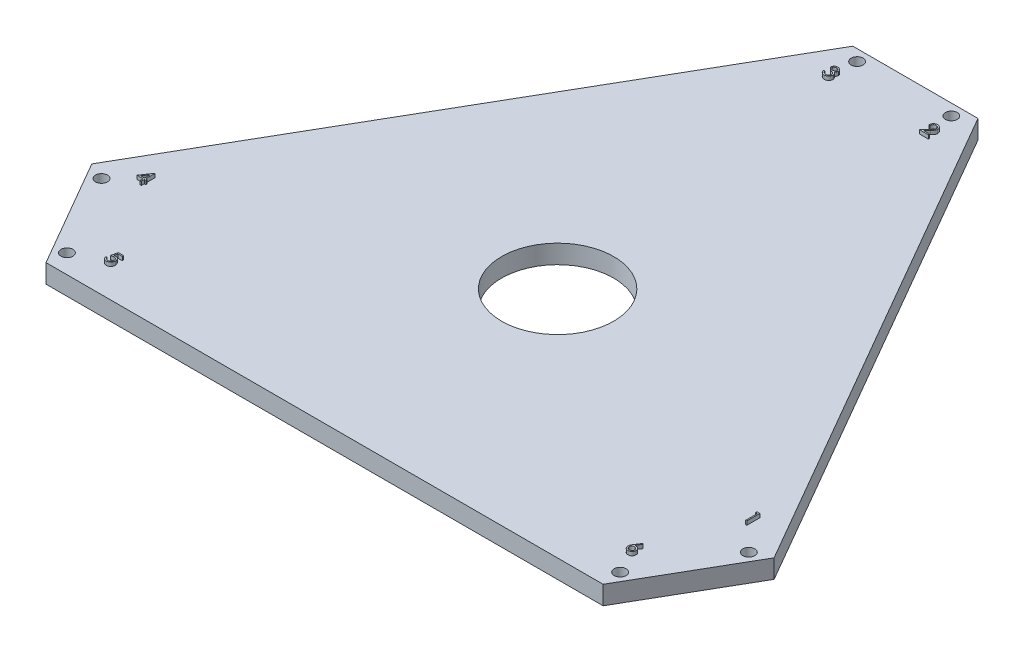
from build123d import *

# Parameters (mm, degrees)
BOSS_EXTRUDE1_DEPTH = 5
BOSS_EXTRUDE2_DEPTH = 1


with BuildPart() as part:
    # Sketch1 → Boss-Extrude1 (new body)
    with BuildSketch(Plane(origin=(0, 0, 0), x_dir=(1, 0, 0), z_dir=(0, 1, 0))):
        Polygon((-74.571158545, -62.397936895), (74.571158545, -62.397936895), (91.323777767, -33.381549243), (16.752619222, 95.779486137), (-16.752619222, 95.779486137), (-91.323777767, -33.381549243), align=None)
        with BuildLine():
            ThreePointArc((0, 15), (-15, 0), (0, -15))
            ThreePointArc((0, -15), (15, 0), (0, 15))
        make_face(mode=Mode.SUBTRACT)
        with BuildLine():
            ThreePointArc((86.654196229, -37.069501717), (88.254196229, -35.469501717), (86.654196229, -33.869501717))
            ThreePointArc((86.654196229, -33.869501717), (85.054196229, -35.469501717), (86.654196229, -37.069501717))
        make_face(mode=Mode.SUBTRACT)
        with BuildLine():
            ThreePointArc((74.044587661, -58.90998442), (75.644587661, -57.30998442), (74.044587661, -55.70998442))
            ThreePointArc((74.044587661, -55.70998442), (72.444587661, -57.30998442), (74.044587661, -58.90998442))
        make_face(mode=Mode.SUBTRACT)
        with BuildLine():
            ThreePointArc((-74.044587661, -58.90998442), (-72.444587661, -57.30998442), (-74.044587661, -55.70998442))
            ThreePointArc((-74.044587661, -55.70998442), (-75.644587661, -57.30998442), (-74.044587661, -58.90998442))
        make_face(mode=Mode.SUBTRACT)
        with BuildLine():
            ThreePointArc((-86.654196229, -37.069501717), (-85.054196229, -35.469501717), (-86.654196229, -33.869501717))
            ThreePointArc((-86.654196229, -33.869501717), (-88.254196229, -35.469501717), (-86.654196229, -37.069501717))
        make_face(mode=Mode.SUBTRACT)
        with BuildLine():
            ThreePointArc((-12.609608568, 94.379486137), (-14.209608568, 92.779486137), (-12.609608568, 91.179486137))
            ThreePointArc((-12.609608568, 91.179486137), (-11.009608568, 92.779486137), (-12.609608568, 94.379486137))
        make_face(mode=Mode.SUBTRACT)
        with BuildLine():
            ThreePointArc((12.609608568, 94.379486137), (11.009608568, 92.779486137), (12.609608568, 91.179486137))
            ThreePointArc((12.609608568, 91.179486137), (14.209608568, 92.779486137), (12.609608568, 94.379486137))
        make_face(mode=Mode.SUBTRACT)
    extrude(amount=BOSS_EXTRUDE1_DEPTH)

    # Sketch2 → Boss-Extrude2 (add)
    # profile 1 of 6: a face of its own
    with BuildSketch(Plane(origin=(0, 5, 0), x_dir=(1, 0, 0), z_dir=(0, 1, 0))):
        Polygon((79.487942702, -25.992269671), (80.135078118, -25.992269671), (80.135078118, -29.492269671), (79.820975554, -29.492269671), (79.820975554, -26.35124403), (79.282514016, -26.35124403), align=None)
    # profile 2 of 6: a face of its own
    with BuildSketch(Plane(origin=(0, 5, 0), x_dir=(1, 0, 0), z_dir=(0, 1, 0))):
        with BuildLine():
            Line((12.979436875, 86.763319042), (12.665334311, 86.763319042))
            add(Edge.make_bspline(
                [(12.665334311, 86.763319042), (12.667381464, 86.80498993), (12.671402018, 86.886830445), (12.690230307, 87.006154351), (12.717171184, 87.12020915), (12.755262638, 87.228079064), (12.802568916, 87.330717871), (12.859298943, 87.427717887), (12.926492794, 87.518709076), (13.002699528, 87.602847919), (13.085468167, 87.68003549), (13.174774107, 87.746690732), (13.268619134, 87.803008404), (13.366718533, 87.850089646), (13.470179096, 87.885429492), (13.578061954, 87.911651131), (13.690841091, 87.927427477), (13.767681113, 87.929123262), (13.806760593, 87.929985709)],
                knots=[0, 0, 0, 0, 1.10065271, 2.161652631, 3.183658789, 4.190468796, 5.17591951, 6.163126047, 7.15150782, 8.156236427, 9.156009102, 10.134482811, 11.092018607, 12.041330605, 13.001268258, 13.972401359, 14.968799086, 16, 16, 16, 16], degree=3))
            add(Edge.make_bspline(
                [(13.806760593, 87.929985709), (13.845138667, 87.929087253), (13.920550212, 87.927321818), (14.030612226, 87.912160789), (14.13538952, 87.888415197), (14.234677287, 87.855099781), (14.327683352, 87.810315353), (14.415106396, 87.756517815), (14.497987207, 87.694297983), (14.572593991, 87.62104417), (14.64110207, 87.542841785), (14.700204325, 87.459353882), (14.750817488, 87.373124596), (14.793005168, 87.283496394), (14.824061307, 87.189625366), (14.847639515, 87.092878163), (14.860966929, 86.992253352), (14.863012352, 86.924146797), (14.86405226, 86.889520966)],
                knots=[0, 0, 0, 0, 1.111607364, 2.184268762, 3.212621178, 4.221274766, 5.211760367, 6.196651075, 7.1921475, 8.207485113, 9.220403448, 10.201281604, 11.166441695, 12.114753415, 13.065576456, 14.026450734, 14.996634279, 16, 16, 16, 16], degree=3))
            add(Edge.make_bspline(
                [(14.86405226, 86.889520966), (14.862358997, 86.840773131), (14.859002185, 86.744132917), (14.830287809, 86.602118055), (14.785441298, 86.464524635), (14.731443941, 86.353787333), (14.676971497, 86.26455384), (14.627883989, 86.191085135), (14.570419178, 86.111979666), (14.50374068, 86.027502329), (14.429227808, 85.936991424), (14.346205645, 85.840501628), (14.254082163, 85.739029859), (14.189423662, 85.669724257), (14.155919247, 85.633811831)],
                knots=[0, 0, 0, 0, 1.184426356, 2.348067706, 3.509069118, 4.696110526, 5.333549288, 6.050745305, 6.844228056, 7.710549037, 8.667450064, 9.695053472, 10.805634456, 12, 12, 12, 12], degree=3))
            Line((14.155919247, 85.633811831), (13.280218125, 84.699216478))
            Line((13.280218125, 84.699216478), (14.908924054, 84.699216478))
            Line((14.908924054, 84.699216478), (14.908924054, 84.340242119))
            Line((14.908924054, 84.340242119), (12.530718926, 84.340242119))
            Line((12.530718926, 84.340242119), (13.888090721, 85.788759748))
            add(Edge.make_bspline(
                [(13.888090721, 85.788759748), (13.921138608, 85.823258054), (13.984616835, 85.889522241), (14.074399412, 85.986265201), (14.1550384, 86.076014742), (14.227055793, 86.15860129), (14.288889298, 86.235232858), (14.34376153, 86.303427561), (14.387727121, 86.366182012), (14.435442517, 86.438922626), (14.481656498, 86.527734943), (14.521368854, 86.636268632), (14.545583703, 86.747995885), (14.548488538, 86.823497922), (14.549949695, 86.861476094)],
                knots=[0, 0, 0, 0, 1.329631726, 2.553950428, 3.673215718, 4.687767853, 5.603093632, 6.413772471, 7.123043292, 7.734684054, 8.834405432, 9.900288307, 10.943827018, 12, 12, 12, 12], degree=3))
            add(Edge.make_bspline(
                [(14.549949695, 86.861476094), (14.549313953, 86.885357492), (14.548061027, 86.932423143), (14.53700333, 87.001428902), (14.520292824, 87.067993715), (14.496347565, 87.132322334), (14.464740825, 87.193767987), (14.426267445, 87.252405467), (14.381877382, 87.309094432), (14.330526113, 87.36224773), (14.274114593, 87.410928935), (14.214520343, 87.454053021), (14.151470239, 87.490092132), (14.085230117, 87.519635629), (14.015984647, 87.54281101), (13.943599902, 87.558869589), (13.868275886, 87.568952073), (13.81684239, 87.570316245), (13.790634792, 87.57101135)],
                knots=[0, 0, 0, 0, 0.991446411, 1.95395049, 2.89581595, 3.838931463, 4.798493298, 5.75982156, 6.748411868, 7.785213223, 8.824556874, 9.840280684, 10.836137867, 11.835679398, 12.848801643, 13.863922112, 14.911575587, 16, 16, 16, 16], degree=3))
            add(Edge.make_bspline(
                [(13.790634792, 87.57101135), (13.763263959, 87.570296318), (13.709512163, 87.568892113), (13.63059313, 87.559069449), (13.555307352, 87.542123608), (13.483465449, 87.518946934), (13.414945863, 87.489488385), (13.350081819, 87.45279664), (13.28901893, 87.409013147), (13.231642407, 87.359372591), (13.178778428, 87.30410499), (13.132331552, 87.242495027), (13.091747538, 87.175667611), (13.056338304, 87.103803061), (13.027582614, 87.026249281), (13.005609464, 86.943281576), (12.988222617, 86.855260194), (12.982414096, 86.794475109), (12.979436875, 86.763319042)],
                knots=[0, 0, 0, 0, 1.031018746, 2.02475058, 2.990194455, 3.934040569, 4.864654155, 5.795059489, 6.735614925, 7.690564532, 8.649604399, 9.611025574, 10.590972636, 11.591080095, 12.624614302, 13.701020113, 14.821632451, 16, 16, 16, 16], degree=3))
        make_face()
    # profile 3 of 6: a face of its own
    with BuildSketch(Plane(origin=(0, 5, 0), x_dir=(1, 0, 0), z_dir=(0, 1, 0))):
        with BuildLine():
            Line((-13.626834141, 87.032549812), (-13.940936705, 87.032549812))
            add(Edge.make_bspline(
                [(-13.940936705, 87.032549812), (-13.932427155, 87.067782296), (-13.915791679, 87.13665892), (-13.881094106, 87.235066181), (-13.84329485, 87.328189702), (-13.797905746, 87.414285776), (-13.748396992, 87.495084679), (-13.69167427, 87.568753803), (-13.630354547, 87.637166769), (-13.562529598, 87.697880006), (-13.491400936, 87.752857735), (-13.415966317, 87.799732793), (-13.337743423, 87.840056946), (-13.25619029, 87.873277178), (-13.171064118, 87.898302701), (-13.083134495, 87.916459507), (-12.992170995, 87.928250621), (-12.930423404, 87.929401384), (-12.899069718, 87.929985709)],
                knots=[0, 0, 0, 0, 1.162005537, 2.271625781, 3.343758855, 4.383309926, 5.390229558, 6.379919256, 7.361854164, 8.333198761, 9.295911338, 10.242430842, 11.177959212, 12.116337295, 13.062827104, 14.020064771, 14.994644689, 16, 16, 16, 16], degree=3))
            add(Edge.make_bspline(
                [(-12.899069718, 87.929985709), (-12.853386976, 87.928606479), (-12.763017965, 87.925878103), (-12.630254918, 87.900963667), (-12.502228099, 87.861538535), (-12.380338851, 87.807064807), (-12.267120419, 87.739877494), (-12.166384232, 87.659912757), (-12.079495721, 87.568713456), (-12.006601343, 87.467980892), (-11.949526344, 87.360325382), (-11.907439971, 87.249525225), (-11.88181829, 87.135843254), (-11.878497733, 87.059085974), (-11.876834141, 87.020630741)],
                knots=[0, 0, 0, 0, 1.083050992, 2.142477498, 3.193116406, 4.255571735, 5.30263384, 6.308962982, 7.297363603, 8.282367274, 9.249857812, 10.179914175, 11.08814088, 12, 12, 12, 12], degree=3))
            add(Edge.make_bspline(
                [(-11.876834141, 87.020630741), (-11.877997732, 86.983623946), (-11.880274699, 86.911207392), (-11.899608405, 86.805485895), (-11.932144668, 86.705844295), (-11.97721443, 86.611863132), (-12.035555981, 86.524138293), (-12.106228677, 86.442472402), (-12.189731339, 86.366503244), (-12.253010277, 86.322983771), (-12.285588148, 86.300578658)],
                knots=[0, 0, 0, 0, 1.024540389, 2.004866551, 2.965041327, 3.920577974, 4.882998113, 5.874504559, 6.905732034, 8, 8, 8, 8], degree=3))
            add(Edge.make_bspline(
                [(-12.285588148, 86.300578658), (-12.248356393, 86.282600486), (-12.174589519, 86.246980529), (-12.074038989, 86.177124771), (-11.982761114, 86.096468424), (-11.931857395, 86.033525771), (-11.906281257, 86.001900773)],
                knots=[0, 0, 0, 0, 1.015518401, 2.012035669, 3.001164323, 4, 4, 4, 4], degree=3))
            add(Edge.make_bspline(
                [(-11.906281257, 86.001900773), (-11.889439914, 85.978843022), (-11.856033018, 85.933105105), (-11.814797484, 85.859568679), (-11.77738837, 85.78521719), (-11.748238151, 85.708057784), (-11.725664284, 85.62898477), (-11.709528252, 85.547862374), (-11.699504111, 85.464624352), (-11.698068559, 85.408311871), (-11.697346962, 85.380005741)],
                knots=[0, 0, 0, 0, 1.025084078, 2.033381695, 3.024893161, 4.013698104, 4.991890475, 5.976764909, 6.982997093, 8, 8, 8, 8], degree=3))
            add(Edge.make_bspline(
                [(-11.697346962, 85.380005741), (-11.699141475, 85.33099602), (-11.702722057, 85.233207218), (-11.734726131, 85.088732497), (-11.784339372, 84.947506994), (-11.854796308, 84.812432155), (-11.940663817, 84.686051774), (-12.042821141, 84.572975465), (-12.16010755, 84.475776861), (-12.290913198, 84.394566633), (-12.432630327, 84.32964871), (-12.584205919, 84.284591268), (-12.743455973, 84.255245268), (-12.85266327, 84.252098399), (-12.908184301, 84.25049853)],
                knots=[0, 0, 0, 0, 0.955779014, 1.907060117, 2.875433937, 3.871313158, 4.872415639, 5.851225146, 6.836215519, 7.83643374, 8.849228613, 9.86973379, 10.916971861, 12, 12, 12, 12], degree=3))
            add(Edge.make_bspline(
                [(-12.908184301, 84.25049853), (-12.945603602, 84.251366743), (-13.019232307, 84.253075097), (-13.127475805, 84.264753698), (-13.230797504, 84.286083704), (-13.329337102, 84.314787009), (-13.423182139, 84.351178751), (-13.512046244, 84.396497449), (-13.596476137, 84.449808951), (-13.675675089, 84.511742539), (-13.749633656, 84.581023879), (-13.816386381, 84.658882889), (-13.877046173, 84.743880292), (-13.929988812, 84.837003349), (-13.977625765, 84.937048606), (-14.016806721, 85.045297104), (-14.05129229, 85.160781126), (-14.067325754, 85.241258867), (-14.07555209, 85.282549812)],
                knots=[0, 0, 0, 0, 1.048658725, 2.063410685, 3.046034179, 4.001477787, 4.936774919, 5.862367409, 6.792675028, 7.730719943, 8.675894397, 9.627829632, 10.600096036, 11.597688215, 12.626045268, 13.701542398, 14.82072376, 16, 16, 16, 16], degree=3))
            Line((-14.07555209, 85.282549812), (-13.761449526, 85.282549812))
            add(Edge.make_bspline(
                [(-13.761449526, 85.282549812), (-13.753266234, 85.255600798), (-13.737349022, 85.203182627), (-13.710254724, 85.127742321), (-13.679386452, 85.058584268), (-13.646271893, 84.995201146), (-13.611493447, 84.936968743), (-13.572578522, 84.885426874), (-13.532409377, 84.838311672), (-13.502130023, 84.81176706), (-13.487310904, 84.798775773)],
                knots=[0, 0, 0, 0, 1.198163088, 2.33053128, 3.407730985, 4.417276592, 5.372219308, 6.28897303, 7.162600585, 8, 8, 8, 8], degree=3))
            add(Edge.make_bspline(
                [(-13.487310904, 84.798775773), (-13.467714327, 84.783667439), (-13.428581665, 84.753497408), (-13.364813433, 84.714995779), (-13.297748547, 84.681634754), (-13.225933873, 84.656151058), (-13.150919103, 84.634573397), (-13.071491737, 84.620452878), (-12.98835252, 84.610764707), (-12.931584757, 84.609909775), (-12.902575327, 84.609472889)],
                knots=[0, 0, 0, 0, 0.946170439, 1.889420265, 2.845303464, 3.807233317, 4.801018734, 5.828864929, 6.890507805, 8, 8, 8, 8], degree=3))
            add(Edge.make_bspline(
                [(-12.902575327, 84.609472889), (-12.869821824, 84.610088794), (-12.805775177, 84.611293143), (-12.712320318, 84.62236885), (-12.623412871, 84.638499264), (-12.540039945, 84.663412247), (-12.461109437, 84.694193098), (-12.387727788, 84.732841503), (-12.318931682, 84.778186225), (-12.255602276, 84.829725384), (-12.198656769, 84.886146879), (-12.148517255, 84.94515995), (-12.105892594, 85.006515779), (-12.071509016, 85.0705539), (-12.044358465, 85.137009129), (-12.025875265, 85.206067959), (-12.01302375, 85.277165225), (-12.011977138, 85.325494194), (-12.011449526, 85.349857504)],
                knots=[0, 0, 0, 0, 1.217147791, 2.380027433, 3.494444702, 4.572153297, 5.609568379, 6.639424714, 7.649109417, 8.668170816, 9.669597737, 10.625200337, 11.543417969, 12.441394052, 13.322311151, 14.205496177, 15.095365482, 16, 16, 16, 16], degree=3))
            add(Edge.make_bspline(
                [(-12.011449526, 85.349857504), (-12.012979827, 85.382468843), (-12.016032816, 85.447529251), (-12.039341395, 85.543246825), (-12.077680259, 85.635470238), (-12.131352771, 85.722626028), (-12.196688499, 85.803401929), (-12.273053406, 85.875473412), (-12.361081635, 85.934943503), (-12.442101504, 85.976032159), (-12.51386666, 86.004069235), (-12.575282045, 86.022744199), (-12.644038648, 86.038557855), (-12.719304997, 86.053270126), (-12.801648213, 86.065791474), (-12.890978651, 86.07623329), (-12.987314413, 86.084588331), (-13.054005579, 86.088319426), (-13.088372603, 86.090242119)],
                knots=[0, 0, 0, 0, 1.07054697, 2.135767047, 3.216561865, 4.33974944, 5.486079747, 6.621378074, 7.775625952, 8.963672916, 9.598146892, 10.304877434, 11.070270905, 11.915000392, 12.823868403, 13.805723172, 14.86925407, 16, 16, 16, 16], degree=3))
            Line((-13.088372603, 86.090242119), (-13.088372603, 86.449216478))
            add(Edge.make_bspline(
                [(-13.088372603, 86.449216478), (-13.045071437, 86.449951282), (-12.96025509, 86.451390582), (-12.836360786, 86.468798592), (-12.717887473, 86.492879221), (-12.607460731, 86.529764413), (-12.506812018, 86.57260471), (-12.419492416, 86.622456919), (-12.346725269, 86.677871668), (-12.288864197, 86.739704278), (-12.245334969, 86.806019325), (-12.213508171, 86.875135983), (-12.194707845, 86.947660044), (-12.192198178, 86.997154712), (-12.190936705, 87.022032985)],
                knots=[0, 0, 0, 0, 1.321986639, 2.589447074, 3.816329219, 5.01088745, 6.139805852, 7.153945165, 8.075214402, 8.924034688, 9.728124013, 10.488707548, 11.240355623, 12, 12, 12, 12], degree=3))
            add(Edge.make_bspline(
                [(-12.190936705, 87.022032985), (-12.191351116, 87.04031073), (-12.192175567, 87.076673437), (-12.202572845, 87.129798506), (-12.218196886, 87.181299452), (-12.239676615, 87.230957262), (-12.268426814, 87.278427536), (-12.3028328, 87.324114985), (-12.343800901, 87.367758764), (-12.390746348, 87.408439083), (-12.441158153, 87.44720832), (-12.496407928, 87.480121957), (-12.554829802, 87.508267019), (-12.616488457, 87.531476522), (-12.681583988, 87.54893581), (-12.749810545, 87.561471651), (-12.821298229, 87.569309306), (-12.870069961, 87.570437722), (-12.894862987, 87.57101135)],
                knots=[0, 0, 0, 0, 0.884392785, 1.759457502, 2.611959086, 3.489218968, 4.37281399, 5.2945488, 6.255912374, 7.266815255, 8.301784654, 9.332968512, 10.37626691, 11.440494194, 12.520033166, 13.637162961, 14.798855837, 16, 16, 16, 16], degree=3))
            add(Edge.make_bspline(
                [(-12.894862987, 87.57101135), (-12.934714655, 87.569619988), (-13.012554232, 87.566902335), (-13.124769149, 87.543099321), (-13.229088483, 87.505121238), (-13.308827149, 87.459788218), (-13.367709723, 87.415037784), (-13.409786662, 87.375955398), (-13.451107172, 87.332522574), (-13.488952849, 87.282064199), (-13.527226825, 87.227997409), (-13.562071387, 87.167573727), (-13.595931079, 87.102369333), (-13.616333629, 87.056273698), (-13.626834141, 87.032549812)],
                knots=[0, 0, 0, 0, 1.472543308, 2.876219568, 4.221790263, 5.565193594, 6.249813518, 6.953379497, 7.687249741, 8.463570142, 9.283606569, 10.136032583, 11.040678096, 12, 12, 12, 12], degree=3))
        make_face()
    # profile 4 of 6: a face of its own
    with BuildSketch(Plane(origin=(0, 5, 0), x_dir=(1, 0, 0), z_dir=(0, 1, 0))):
        Polygon((-79.7388767, -28.170105997), (-79.675074616, -28.170105997), (-79.675074616, -30.59318292), (-79.271228463, -30.59318292), (-79.271228463, -30.952157279), (-79.675074616, -30.952157279), (-79.675074616, -31.759849587), (-79.989177181, -31.759849587), (-79.989177181, -30.952157279), (-81.649433591, -30.952157279), align=None)
        Polygon((-79.989177181, -30.59318292), (-79.989177181, -29.073150869), (-81.032446411, -30.59318292), align=None, mode=Mode.SUBTRACT)
    # profile 5 of 6: a face of its own
    with BuildSketch(Plane(origin=(0, 5, 0), x_dir=(1, 0, 0), z_dir=(0, 1, 0))):
        with BuildLine():
            Line((-64.787032184, -51.389164732), (-64.787032184, -51.74813909))
            Line((-64.787032184, -51.74813909), (-65.977536992, -51.74813909))
            Line((-65.977536992, -51.74813909), (-66.166138755, -52.668712007))
            add(Edge.make_bspline(
                [(-66.166138755, -52.668712007), (-66.12908288, -52.658481735), (-66.057292985, -52.638662202), (-65.951333124, -52.616656431), (-65.85074092, -52.603390987), (-65.78546555, -52.601579677), (-65.753879139, -52.600703193)],
                knots=[0, 0, 0, 0, 1.100273476, 2.13160584, 3.095893838, 4, 4, 4, 4], degree=3))
            add(Edge.make_bspline(
                [(-65.753879139, -52.600703193), (-65.7147954, -52.601549129), (-65.637947002, -52.60321245), (-65.525508055, -52.619184299), (-65.418175162, -52.644324214), (-65.316172792, -52.679444735), (-65.219312241, -52.724354469), (-65.12848468, -52.780454409), (-65.042326767, -52.84598774), (-64.962384173, -52.921332752), (-64.889859865, -53.004254369), (-64.826093875, -53.09341224), (-64.771931285, -53.187939902), (-64.72837053, -53.288740511), (-64.693586196, -53.394699664), (-64.670434201, -53.506932247), (-64.655017492, -53.624380367), (-64.653295106, -53.704684937), (-64.6524168, -53.745635084)],
                knots=[0, 0, 0, 0, 1.052922333, 2.070308379, 3.05430497, 4.020497103, 4.973039431, 5.925935799, 6.892292201, 7.88610001, 8.88166317, 9.857072816, 10.836096531, 11.812156883, 12.81219415, 13.836441305, 14.89672472, 16, 16, 16, 16], degree=3))
            add(Edge.make_bspline(
                [(-64.6524168, -53.745635084), (-64.653081875, -53.774157304), (-64.654403038, -53.830816292), (-64.661121625, -53.914960493), (-64.674057341, -53.997323326), (-64.691425065, -54.077915718), (-64.713967483, -54.15658509), (-64.741256537, -54.233556618), (-64.774652565, -54.308351224), (-64.81128394, -54.381676619), (-64.852530418, -54.451875127), (-64.898308925, -54.517524113), (-64.946674417, -54.579608395), (-64.998715802, -54.637462128), (-65.054916797, -54.690705146), (-65.114596764, -54.739653427), (-65.177279483, -54.785134757), (-65.243934725, -54.825302953), (-65.313077208, -54.862265909), (-65.385705426, -54.892589446), (-65.460166126, -54.919699974), (-65.537531002, -54.941309502), (-65.617624814, -54.958242056), (-65.70057959, -54.969742657), (-65.78596026, -54.978119094), (-65.843835272, -54.978643451), (-65.873069845, -54.978908321)],
                knots=[0, 0, 0, 0, 1.056347294, 2.098418968, 3.122841568, 4.141288669, 5.149314143, 6.15115421, 7.162517403, 8.180376062, 9.185164535, 10.17417709, 11.141909838, 12.097768115, 13.052685741, 14.0056014, 14.954263652, 15.917497458, 16.885230207, 17.854509472, 18.828990115, 19.81800267, 20.826176721, 21.857883937, 22.917946725, 24, 24, 24, 24], degree=3))
            add(Edge.make_bspline(
                [(-65.873069845, -54.978908321), (-65.907944025, -54.978217483), (-65.976554856, -54.976858341), (-66.077075423, -54.962639856), (-66.173790029, -54.94227594), (-66.26592013, -54.91163967), (-66.354291394, -54.873252375), (-66.437714111, -54.824736203), (-66.518319887, -54.7697571), (-66.592831924, -54.704876747), (-66.661988038, -54.633961065), (-66.723894547, -54.557003424), (-66.779028123, -54.475273981), (-66.82650587, -54.388375827), (-66.867003892, -54.296537296), (-66.89881888, -54.199414296), (-66.924497235, -54.097514292), (-66.935360655, -54.027360781), (-66.940878338, -53.991728834)],
                knots=[0, 0, 0, 0, 1.0467383, 2.05933395, 3.04377827, 4.011590433, 4.970194871, 5.932262533, 6.905835911, 7.896367577, 8.894135286, 9.877477877, 10.858688626, 11.851381753, 12.8477658, 13.868841284, 14.917554742, 16, 16, 16, 16], degree=3))
            Line((-66.940878338, -53.991728834), (-66.626775774, -53.991728834))
            add(Edge.make_bspline(
                [(-66.626775774, -53.991728834), (-66.619047217, -54.025105287), (-66.6041925, -54.089256681), (-66.571586752, -54.179388023), (-66.531720876, -54.259707246), (-66.484316528, -54.33127683), (-66.427766497, -54.393685827), (-66.363237068, -54.449302889), (-66.290889345, -54.499478018), (-66.210496115, -54.541300785), (-66.125683036, -54.576969539), (-66.036915826, -54.600721234), (-65.94661148, -54.617422127), (-65.885533109, -54.619093887), (-65.854840678, -54.619933962)],
                knots=[0, 0, 0, 0, 1.136247022, 2.183929868, 3.172523383, 4.106158343, 5.02341133, 5.958108904, 6.928429099, 7.938127109, 8.96079061, 9.975095812, 10.982467395, 12, 12, 12, 12], degree=3))
            add(Edge.make_bspline(
                [(-65.854840678, -54.619933962), (-65.824882234, -54.619113184), (-65.765893811, -54.617497066), (-65.679082425, -54.605058054), (-65.59526955, -54.585900483), (-65.515282194, -54.557230628), (-65.437720654, -54.522385909), (-65.364546884, -54.477670833), (-65.293644007, -54.426210815), (-65.227215873, -54.367254185), (-65.166376424, -54.30228449), (-65.112620303, -54.232807097), (-65.067843389, -54.15869025), (-65.03010928, -54.081217097), (-65.001455982, -53.99953854), (-64.981015, -53.914037365), (-64.969011941, -53.824502385), (-64.967360761, -53.763433075), (-64.966519364, -53.73231377)],
                knots=[0, 0, 0, 0, 1.027316725, 2.022795036, 3.002884548, 3.971462791, 4.93288096, 5.914575861, 6.907176829, 7.935150275, 8.956128384, 9.956726525, 10.942570165, 11.921478529, 12.907843606, 13.90538589, 14.932640048, 16, 16, 16, 16], degree=3))
            add(Edge.make_bspline(
                [(-64.966519364, -53.73231377), (-64.967177843, -53.704238018), (-64.968466723, -53.649283729), (-64.978997293, -53.568884523), (-64.997314266, -53.492811481), (-65.022738146, -53.420697247), (-65.055017653, -53.352473804), (-65.094463966, -53.288070744), (-65.141817364, -53.228336911), (-65.195909252, -53.173244357), (-65.255167293, -53.122399482), (-65.320611036, -53.079055396), (-65.390870963, -53.042591478), (-65.465100562, -53.01112348), (-65.545065461, -52.988522734), (-65.629182093, -52.971554849), (-65.718358801, -52.961739486), (-65.779329489, -52.960377598), (-65.810670005, -52.959677552)],
                knots=[0, 0, 0, 0, 1.045622112, 2.046656509, 3.013763289, 3.955457236, 4.890082067, 5.820317437, 6.762574623, 7.722996705, 8.69280354, 9.665887285, 10.63943826, 11.638615906, 12.663482002, 13.728887084, 14.832589034, 16, 16, 16, 16], degree=3))
            add(Edge.make_bspline(
                [(-65.810670005, -52.959677552), (-65.837798934, -52.960258143), (-65.893813289, -52.961456917), (-65.979736116, -52.970283413), (-66.070027839, -52.984522708), (-66.164342334, -53.004108955), (-66.262962842, -53.029740032), (-66.365681243, -53.060454533), (-66.47271351, -53.097176531), (-66.544831234, -53.124908745), (-66.581903979, -53.139164732)],
                knots=[0, 0, 0, 0, 0.817624296, 1.688186739, 2.600797293, 3.572016777, 4.590301741, 5.671205678, 6.80286297, 8, 8, 8, 8], degree=3))
            Line((-66.581903979, -53.139164732), (-66.22292962, -51.389164732))
            Line((-66.22292962, -51.389164732), (-64.787032184, -51.389164732))
        make_face()
    # profile 6 of 6: a face of its own
    with BuildSketch(Plane(origin=(0, 5, 0), x_dir=(1, 0, 0), z_dir=(0, 1, 0))):
        with BuildLine():
            Line((71.440289423, -48.578325242), (71.682176442, -48.768329249))
            Line((71.682176442, -48.768329249), (70.757396794, -50.182491909))
            add(Edge.make_bspline(
                [(70.757396794, -50.182491909), (70.818967071, -50.172678048), (70.939066858, -50.153535004), (71.060632757, -50.150377058), (71.119876762, -50.148838063)],
                knots=[0, 0, 0, 0, 1.025318673, 2, 2, 2, 2], degree=3))
            add(Edge.make_bspline(
                [(71.119876762, -50.148838063), (71.155449259, -50.149794175), (71.225472659, -50.151676252), (71.328279461, -50.166160103), (71.427068397, -50.188985215), (71.52143001, -50.222257471), (71.611702991, -50.264759825), (71.698405388, -50.315698695), (71.779907398, -50.377704376), (71.857258577, -50.446969331), (71.927485674, -50.523686316), (71.98966173, -50.605087653), (72.041888522, -50.691088534), (72.084262443, -50.7816454), (72.117167322, -50.876618659), (72.141154967, -50.975886799), (72.15533456, -51.07951827), (72.15726005, -51.149996445), (72.158238141, -51.185797198)],
                knots=[0, 0, 0, 0, 1.04369286, 2.054478336, 3.041073146, 4.015093852, 4.984733326, 5.965804835, 6.960378782, 7.985147595, 9.009457201, 10.008161701, 10.986880575, 11.956520048, 12.937015923, 13.931873656, 14.949455224, 16, 16, 16, 16], degree=3))
            add(Edge.make_bspline(
                [(72.158238141, -51.185797198), (72.156815036, -51.234776901), (72.154014702, -51.331157367), (72.126110906, -51.471534074), (72.082751261, -51.605266589), (72.020773733, -51.730219761), (71.94379135, -51.84622233), (71.849913757, -51.949007796), (71.742470269, -52.040677833), (71.620983471, -52.117334452), (71.490240507, -52.179937503), (71.352888509, -52.224902745), (71.210261363, -52.252586215), (71.113456755, -52.256056817), (71.064488141, -52.257812422)],
                knots=[0, 0, 0, 0, 1.031375318, 2.029502543, 3.004789286, 3.987476834, 4.960371455, 5.9300674, 6.912260825, 7.929083631, 8.949397511, 9.960523116, 10.96833055, 12, 12, 12, 12], degree=3))
            add(Edge.make_bspline(
                [(71.064488141, -52.257812422), (71.01739144, -52.256284216), (70.924101122, -52.253257108), (70.786868328, -52.22629117), (70.65500531, -52.182584067), (70.529435929, -52.122369789), (70.413115317, -52.046311906), (70.30904968, -51.954749627), (70.217757906, -51.849640162), (70.141783285, -51.730999815), (70.081524553, -51.603509857), (70.036334628, -51.470572701), (70.009938384, -51.332672719), (70.006249827, -51.23919158), (70.004391987, -51.192107294)],
                knots=[0, 0, 0, 0, 1.012016664, 2.004627821, 2.994792927, 3.992885782, 4.990978636, 5.973936114, 6.964471063, 7.975201453, 8.993600317, 9.990122807, 10.98767138, 12, 12, 12, 12], degree=3))
            add(Edge.make_bspline(
                [(70.004391987, -51.192107294), (70.005573432, -51.15606271), (70.007985717, -51.082466558), (70.024829107, -50.971002531), (70.051893902, -50.856951449), (70.082204148, -50.760197255), (70.114229758, -50.680935733), (70.140882298, -50.617032243), (70.174056294, -50.551271169), (70.209429675, -50.481397533), (70.250186544, -50.409212101), (70.294502193, -50.333508431), (70.343601844, -50.255490504), (70.378022007, -50.202546308), (70.395617948, -50.175480691)],
                knots=[0, 0, 0, 0, 1.173818275, 2.396712641, 3.66331629, 4.989737886, 5.693666774, 6.447286557, 7.243889047, 8.091586357, 8.998013824, 9.943181721, 10.948533338, 12, 12, 12, 12], degree=3))
            Line((70.395617948, -50.175480691), (71.440289423, -48.578325242))
        make_face()
        with BuildLine():
            add(Edge.make_bspline(
                [(71.053971314, -50.507812422), (71.027309069, -50.508590466), (70.975229959, -50.510110211), (70.898822545, -50.518935463), (70.826509293, -50.535554528), (70.75733216, -50.55672086), (70.692584457, -50.58582392), (70.631795617, -50.621175719), (70.574730565, -50.662796897), (70.521987013, -50.710097808), (70.47416735, -50.761885841), (70.432986219, -50.817355363), (70.397463819, -50.875169567), (70.368582, -50.935811509), (70.346091924, -50.999258008), (70.329823674, -51.065217258), (70.320769922, -51.134131564), (70.319263691, -51.180864067), (70.318494551, -51.204727486)],
                knots=[0, 0, 0, 0, 1.129588631, 2.206414736, 3.251139165, 4.268635594, 5.265702196, 6.250456724, 7.242448911, 8.251968645, 9.246821453, 10.222880186, 11.173611482, 12.116736599, 13.062300278, 14.020270554, 14.989073742, 16, 16, 16, 16], degree=3))
            add(Edge.make_bspline(
                [(70.318494551, -51.204727486), (70.319120912, -51.228377466), (70.320349114, -51.274751556), (70.331501434, -51.343090735), (70.348536516, -51.408855644), (70.373876912, -51.471707242), (70.4041038, -51.53260356), (70.444009124, -51.589338846), (70.48822591, -51.645358916), (70.541079844, -51.696360387), (70.597803207, -51.743817012), (70.658404409, -51.785297265), (70.721564369, -51.820783438), (70.788135791, -51.848594536), (70.857174175, -51.871418823), (70.929254729, -51.887480302), (71.004427585, -51.896560828), (71.055349523, -51.898069022), (71.081315064, -51.898838063)],
                knots=[0, 0, 0, 0, 0.989467248, 1.94019797, 2.891935182, 3.827694429, 4.772920941, 5.730924762, 6.725747692, 7.756678648, 8.79901574, 9.819492441, 10.826891316, 11.826466727, 12.835195252, 13.867842842, 14.912794438, 16, 16, 16, 16], degree=3))
            add(Edge.make_bspline(
                [(71.081315064, -51.898838063), (71.107280562, -51.898068962), (71.158202417, -51.89656065), (71.233375877, -51.887480981), (71.305454196, -51.871416333), (71.374500704, -51.848603563), (71.441042135, -51.820749953), (71.504146857, -51.785518033), (71.56417495, -51.743561916), (71.62093555, -51.696441487), (71.673569488, -51.645068635), (71.718846767, -51.589838913), (71.75753, -51.532145018), (71.788964187, -51.471947128), (71.814025479, -51.40881764), (71.831146946, -51.343100916), (71.842276235, -51.27474889), (71.843507601, -51.228376566), (71.844135576, -51.204727486)],
                knots=[0, 0, 0, 0, 1.087397944, 2.132534446, 3.165364764, 4.174271784, 5.174024072, 6.181601208, 7.194203697, 8.236725232, 9.267838612, 10.269026844, 11.221737037, 12.171628256, 13.107553087, 14.05945871, 15.010357665, 16, 16, 16, 16], degree=3))
            add(Edge.make_bspline(
                [(71.844135576, -51.204727486), (71.843585284, -51.180832935), (71.842505237, -51.133935703), (71.830289289, -51.065248084), (71.813346915, -50.998922878), (71.787763884, -50.935376929), (71.754527339, -50.874861002), (71.714043932, -50.817069401), (71.667211362, -50.761559054), (71.613113822, -50.709996245), (71.554223589, -50.662849167), (71.491608003, -50.621229611), (71.426100029, -50.586104634), (71.357766087, -50.556797532), (71.285823204, -50.535648058), (71.211432865, -50.518994815), (71.133643623, -50.510132797), (71.080867014, -50.508595732), (71.053971314, -50.507812422)],
                knots=[0, 0, 0, 0, 0.978206639, 1.919901502, 2.851605144, 3.780102724, 4.718870031, 5.675451981, 6.667674623, 7.690630536, 8.733308323, 9.756129687, 10.767539656, 11.776269907, 12.797430371, 13.836405707, 14.897401972, 16, 16, 16, 16], degree=3))
        make_face(mode=Mode.SUBTRACT)
    extrude(amount=BOSS_EXTRUDE2_DEPTH)


solid = part.part
